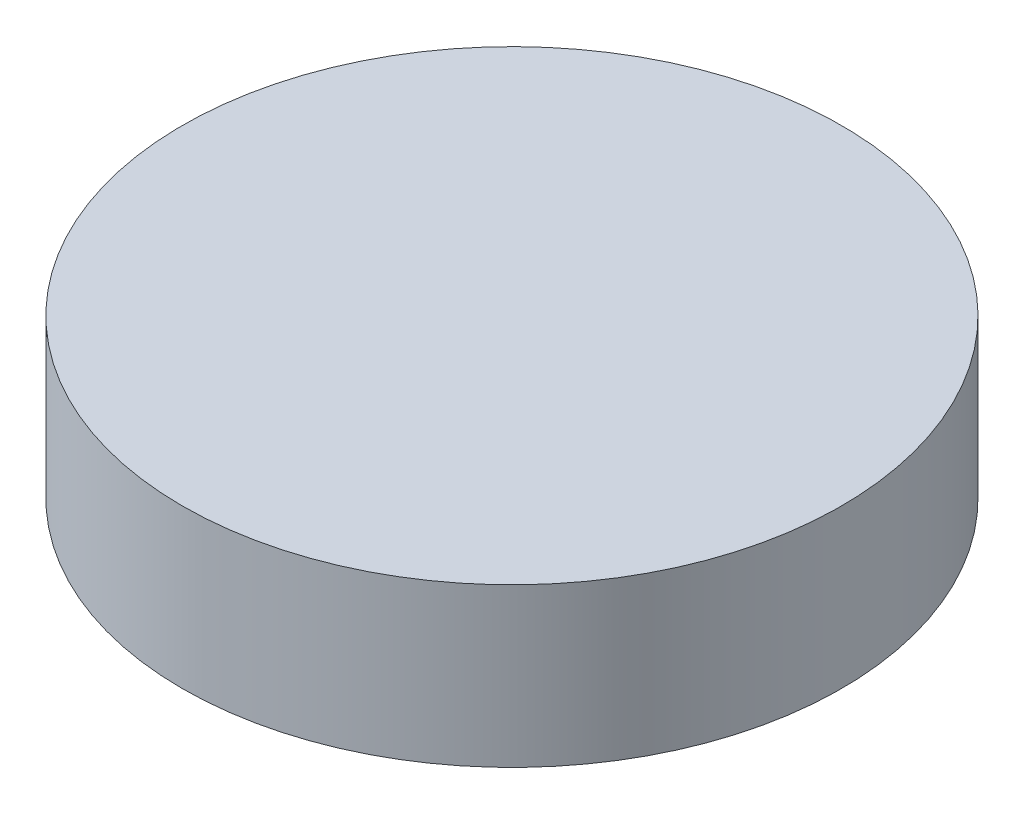
from build123d import *

# Parameters (mm, degrees)
SKETCH1_R               = 25
PACK_AYAR_AYAGI_1_DEPTH = 12


with BuildPart() as part:
    # Sketch1 → PACK_ayar_ayagi_1 (new body)
    with BuildSketch(Plane(origin=(0, 0, 0), x_dir=(1, 0, 0), z_dir=(0, 1, 0))):
        with Locations(Location((50, 50, 0), (0, 0, 270))):
            Circle(SKETCH1_R)
    extrude(amount=PACK_AYAR_AYAGI_1_DEPTH)


solid = part.part
